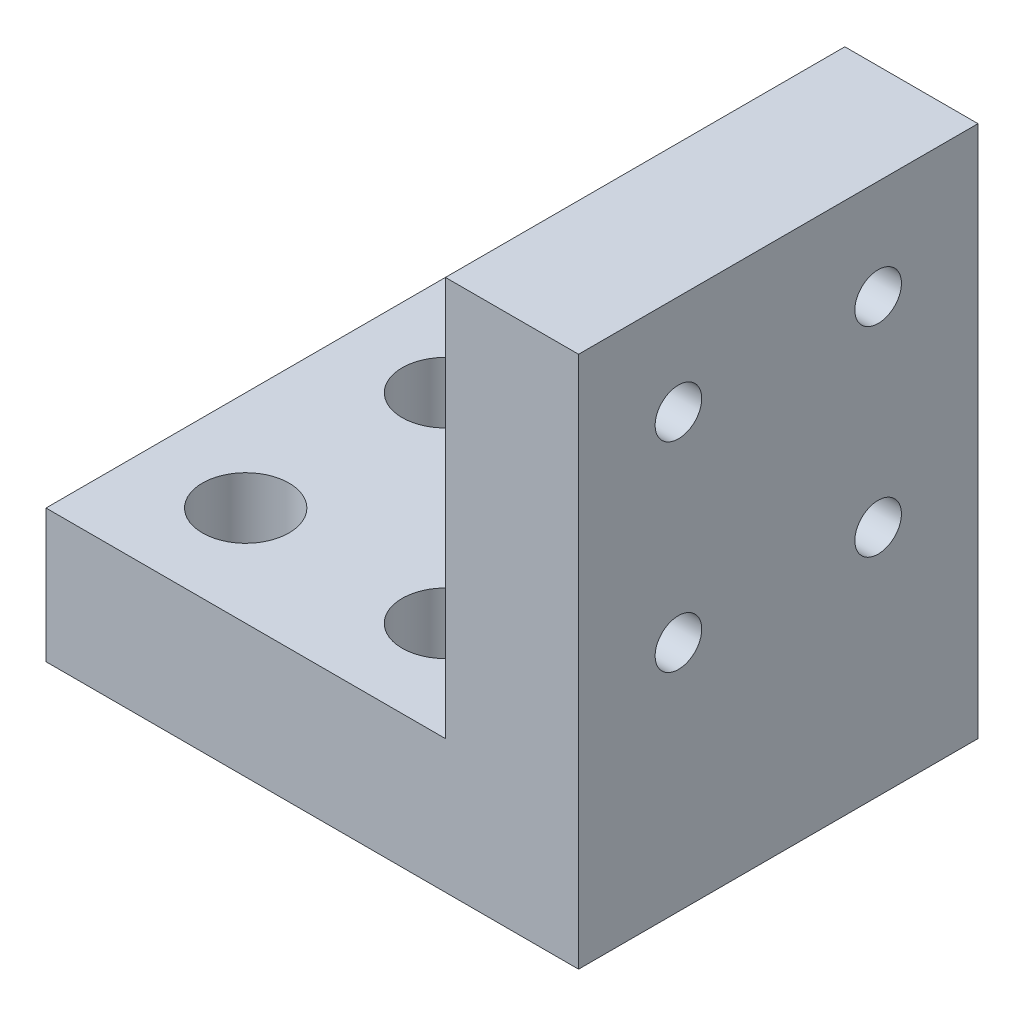
from build123d import *

# Parameters (mm, degrees)
ESBO_O1_W                = 40
ESBO_O1_H                = 30
RESSALTO_EXTRUS_O1_DEPTH = 10
ESBO_O2_W                = 10
ESBO_O2_H                = 30
RESSALTO_EXTRUS_O2_DEPTH = 30
ESBO_O4_R                = 3.25
CORTE_EXTRUS_O1_DEPTH    = 6
ESBO_O5_R                = 1.75
CORTE_EXTRUS_O2_DEPTH    = 10
ESBO_O6_R                = 3.25
CORTE_EXTRUS_O3_DEPTH    = 6
ESBO_O7_R                = 1.75
CORTE_EXTRUS_O4_DEPTH    = 10


with BuildPart() as part:
    # Esboço1 → Ressalto-extrusão1 (new body)
    with BuildSketch(Plane(origin=(0, 0, 0), x_dir=(1, 0, 0), z_dir=(0, 1, 0))):
        with Locations((20, 15)):
            Rectangle(ESBO_O1_W, ESBO_O1_H)
    extrude(amount=RESSALTO_EXTRUS_O1_DEPTH)

    # Esboço2 → Ressalto-extrusão2 (add)
    with BuildSketch(Plane(origin=(0, 10, 0), x_dir=(1, 0, 0), z_dir=(0, 1, 0))):
        with Locations((35, 15)):
            Rectangle(ESBO_O2_W, ESBO_O2_H)
    extrude(amount=RESSALTO_EXTRUS_O2_DEPTH)

    # Esboço4 → Corte-extrusão1 (cut)
    with BuildSketch(Plane(origin=(0, 10, 0), x_dir=(1, 0, 0), z_dir=(0, 1, 0))):
        with Locations(Location((7.5, 22.5, 0), (0, 0, 270))):
            Circle(ESBO_O4_R)
        with Locations(Location((22.5, 22.5, 0), (0, 0, 270))):
            Circle(ESBO_O4_R)
        with Locations(Location((22.5, 7.5, 0), (0, 0, 270))):
            Circle(ESBO_O4_R)
        with Locations(Location((7.5, 7.5, 0), (0, 0, 270))):
            Circle(ESBO_O4_R)
    extrude(amount=-CORTE_EXTRUS_O1_DEPTH, mode=Mode.SUBTRACT)

    # Esboço5 → Corte-extrusão2 (cut)
    with BuildSketch(Plane(origin=(0, 10, 0), x_dir=(1, 0, 0), z_dir=(0, 1, 0))):
        with Locations(Location((7.5, 22.5, 0), (0, 0, 270))):
            Circle(ESBO_O5_R)
        with Locations(Location((22.5, 22.5, 0), (0, 0, 270))):
            Circle(ESBO_O5_R)
        with Locations(Location((22.5, 7.5, 0), (0, 0, 270))):
            Circle(ESBO_O5_R)
        with Locations(Location((7.5, 7.5, 0), (0, 0, 270))):
            Circle(ESBO_O5_R)
    extrude(amount=-CORTE_EXTRUS_O2_DEPTH, mode=Mode.SUBTRACT)

    # Esboço6 → Corte-extrusão3 (cut)
    with BuildSketch(Plane.ZY.offset(-30)):
        with Locations((-7.5, 32.5)):
            Circle(ESBO_O6_R)
        with Locations((-22.5, 32.5)):
            Circle(ESBO_O6_R)
        with Locations((-22.5, 17.5)):
            Circle(ESBO_O6_R)
        with Locations((-7.5, 17.5)):
            Circle(ESBO_O6_R)
    extrude(amount=-CORTE_EXTRUS_O3_DEPTH, mode=Mode.SUBTRACT)

    # Esboço7 → Corte-extrusão4 (cut)
    with BuildSketch(Plane.ZY.offset(-30)):
        with Locations((-22.5, 32.5)):
            Circle(ESBO_O7_R)
        with Locations((-7.5, 32.5)):
            Circle(ESBO_O7_R)
        with Locations((-7.5, 17.5)):
            Circle(ESBO_O7_R)
        with Locations((-22.5, 17.5)):
            Circle(ESBO_O7_R)
    extrude(amount=-CORTE_EXTRUS_O4_DEPTH, mode=Mode.SUBTRACT)


solid = part.part
